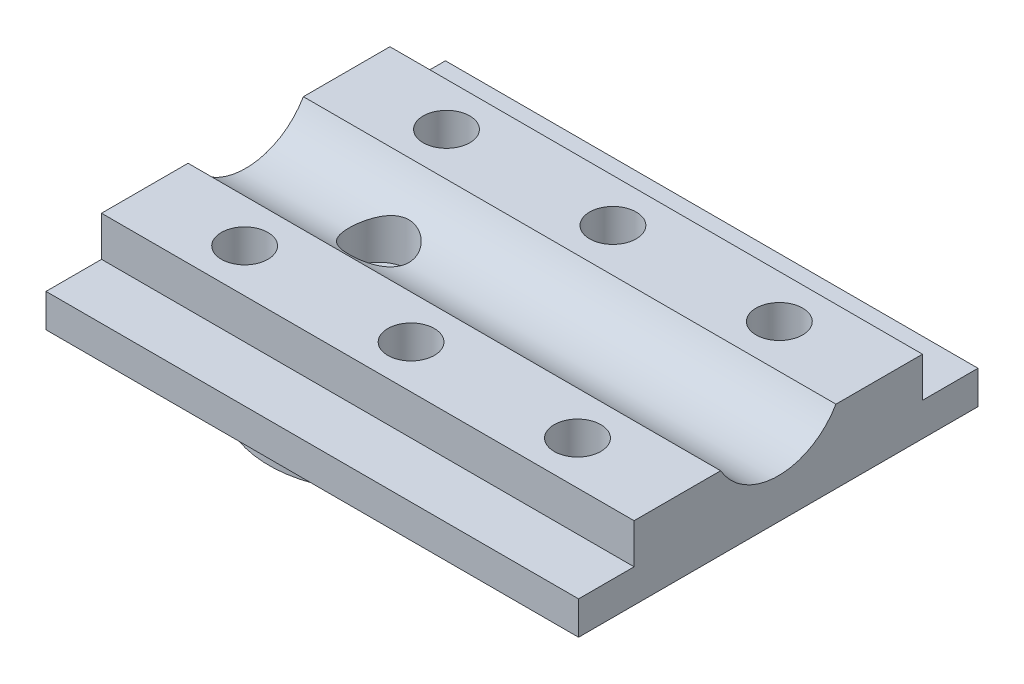
from build123d import *

# Parameters (mm, degrees)
SKETCH_1_W                           = 40
SKETCH_1_H                           = 30
EXTRUDE_1_DEPTH                      = 2.5
SKETCH_2_R                           = 8.25
EXTRUDE_2_DEPTH                      = 7.2
CUT_EXTRUDE_START                    = -2
SKETCH_3_R                           = 6.25
CUT_EXTRUDE_1_DEPTH                  = 2
EXTRUDE_4_DEPTH                      = 1.2
SKETCH_4_R                           = 1.15
CUT_EXTRUDE_2_DEPTH                  = 3.7
CUT_EXTRUDE_4_DEPTH                  = 4
CHAMFER_1_SIZE                       = 0.2
EXTRUDE_5_DEPTH                      = 40
SKETCH_9_R                           = 2.25
CUT_EXTRUDE_5_DEPTH                  = 2.2
CUT_EXTRUDE_5_DIRECTION_2_REACH      = 28.816
CUT_EXTRUDE_5_DIRECTION_2_END_RADIUS = 5
SKETCH_13_W                          = 40
SKETCH_13_H                          = 5
EXTRUDE_6_DEPTH                      = 3
SKETCH_14_R                          = 1.75
CUT_EXTRUDE_7_DEPTH                  = 4


with BuildPart() as part:
    # Эскиз1 → Бобышка-Вытянуть1 (new body)
    with BuildSketch(Plane(origin=(0, 0, 0), x_dir=(1, 0, 0), z_dir=(0, 1, 0))):
        Rectangle(SKETCH_1_W, SKETCH_1_H)
    extrude(amount=EXTRUDE_1_DEPTH)

    # Эскиз2 → Бобышка-Вытянуть2 (add)
    with BuildSketch(Plane.XZ):
        with Locations(Location((-10, 0, 0), (0, 0, 270))):
            Circle(SKETCH_2_R)
        with BuildLine():
            Line((-13.1, 5.427015755), (-13.1, -5.427015755))
            ThreePointArc((-13.1, -5.427015755), (-10, -6.25), (-6.9, -5.427015755))
            Line((-6.9, -5.427015755), (-6.9, 5.427015755))
            ThreePointArc((-6.9, 5.427015755), (-10, 6.25), (-13.1, 5.427015755))
        make_face(mode=Mode.SUBTRACT)
    extrude(amount=EXTRUDE_2_DEPTH)

    # Эскиз3 → Вырез-Вытянуть1 (cut)
    with BuildSketch(Plane.XZ.offset(7.2).offset(CUT_EXTRUDE_START)):
        with Locations(Location((-10, 0, 0), (0, 0, 60.264286892))):
            Circle(SKETCH_3_R)
    extrude(amount=CUT_EXTRUDE_1_DEPTH, mode=Mode.SUBTRACT)

    # Эскиз8 → Бобышка-Вытянуть4 (add)
    with BuildSketch(Plane.XZ):
        with BuildLine():
            Line((-13.1, 5.427015755), (-13.1, -5.427015755))
            ThreePointArc((-13.1, -5.427015755), (-10, -6.25), (-6.9, -5.427015755))
            Line((-6.9, -5.427015755), (-6.9, 5.427015755))
            ThreePointArc((-6.9, 5.427015755), (-10, 6.25), (-13.1, 5.427015755))
        make_face()
    extrude(amount=EXTRUDE_4_DEPTH)

    # Эскиз4 → Вырез-Вытянуть2 (cut)
    with BuildSketch(Plane.XZ.offset(-2.5)):
        with Locations(Location((-10, 0, 0), (0, 0, 270))):
            Circle(SKETCH_4_R)
    extrude(amount=CUT_EXTRUDE_2_DEPTH, mode=Mode.SUBTRACT)

    # Эскиз6 → Вырез-Вытянуть4 (cut)
    with BuildSketch(Plane.XZ.offset(5.2)):
        Polygon((-13.1, 1.25), (-13.1, -1.25), (-13.1, -1.45), (-13.682842712, -1.45), (-14.3, -0.832842712), (-14.3, 0.832842712), (-13.682842712, 1.45), (-13.1, 1.45), align=None)
    extrude(amount=-CUT_EXTRUDE_4_DEPTH, mode=Mode.SUBTRACT)

    # Фаска1
    chamfer_1_edges = [part.edges().sort_by_distance(p)[0] for p in [
        (-13.1, -3.2, -1.45),
        (-13.1, -3.2, 1.45),
    ]]
    chamfer(chamfer_1_edges, length=CHAMFER_1_SIZE)

    # Эскиз10 → Бобышка-Вытянуть5 (add)
    with BuildSketch(Plane.ZY.offset(20)):
        with BuildLine():
            Line((-5.830127019, 5.5), (-5.830127019, 2.5))
            Line((-5.830127019, 2.5), (5.830127019, 2.5))
            Line((5.830127019, 2.5), (5.830127019, 5.5))
            Line((5.830127019, 5.5), (4.330127019, 5.5))
            ThreePointArc((4.330127019, 5.5), (0, 3), (-4.330127019, 5.5))
            Line((-4.330127019, 5.5), (-5.830127019, 5.5))
        make_face()
    extrude(amount=-EXTRUDE_5_DEPTH)

    # Эскиз9 → Вырез-Вытянуть5 (cut)
    with BuildSketch(Plane(origin=(0, 2.5, 0), x_dir=(1, 0, 0), z_dir=(0, 1, 0))):
        with Locations(Location((-10, 0, 0), (0, 0, 90))):
            Circle(SKETCH_9_R)
    extrude(amount=-CUT_EXTRUDE_5_DEPTH, mode=Mode.SUBTRACT)

    # Вырез-Вытянуть5 direction 2: up to this cylinder (the profile starts outside it)
    cut_extrude_5_direction_2_end = Plane(origin=(-10, 8, 0), z_dir=(-1, 0, 0)) * Cylinder(CUT_EXTRUDE_5_DIRECTION_2_END_RADIUS, 68.632, mode=Mode.PRIVATE)
    # Эскиз9 → Вырез-Вытянуть5 direction 2 (cut, up to the surface)
    with BuildSketch(Plane(origin=(0, 2.5, 0), x_dir=(1, 0, 0), z_dir=(0, 1, 0)), mode=Mode.PRIVATE) as cut_extrude_5_direction_2_sk1:
        with Locations(Location((-10, 0, 0), (0, 0, 90))):
            Circle(SKETCH_9_R)
    cut_extrude_5_direction_2_tool1 = extrude(cut_extrude_5_direction_2_sk1.sketch, amount=CUT_EXTRUDE_5_DIRECTION_2_REACH, mode=Mode.PRIVATE) - cut_extrude_5_direction_2_end
    add(cut_extrude_5_direction_2_tool1.solids().sort_by_distance((-10, 2.5, 0))[0], mode=Mode.SUBTRACT)

    # Эскиз13 → Бобышка-Вытянуть6 (add)
    with BuildSketch(Plane(origin=(0, 2.5, 0), x_dir=(1, 0, 0), z_dir=(0, 1, 0))):
        with Locations((0, 8.330127019)):
            Rectangle(SKETCH_13_W, SKETCH_13_H)
        with Locations((0, -8.330127019)):
            Rectangle(SKETCH_13_W, SKETCH_13_H)
    extrude(amount=EXTRUDE_6_DEPTH)

    # Эскиз14 → Вырез-Вытянуть7 (cut)
    with BuildSketch(Plane(origin=(0, 5.5, 0), x_dir=(1, 0, 0), z_dir=(0, 1, 0))):
        with Locations(Location((-12.5, 7.580127019, 0), (0, 0, 270))):
            Circle(SKETCH_14_R)
        with Locations(Location((12.5, 7.580127019, 0), (0, 0, 90))):
            Circle(SKETCH_14_R)
        with Locations(Location((0, 7.580127019, 0), (0, 0, 270))):
            Circle(SKETCH_14_R)
        with Locations(Location((12.5, -7.580127019, 0), (0, 0, 270))):
            Circle(SKETCH_14_R)
        with Locations(Location((0, -7.580127019, 0), (0, 0, 90))):
            Circle(SKETCH_14_R)
        with Locations(Location((-12.5, -7.580127019, 0), (0, 0, 90))):
            Circle(SKETCH_14_R)
    extrude(amount=-CUT_EXTRUDE_7_DEPTH, mode=Mode.SUBTRACT)


solid = part.part
